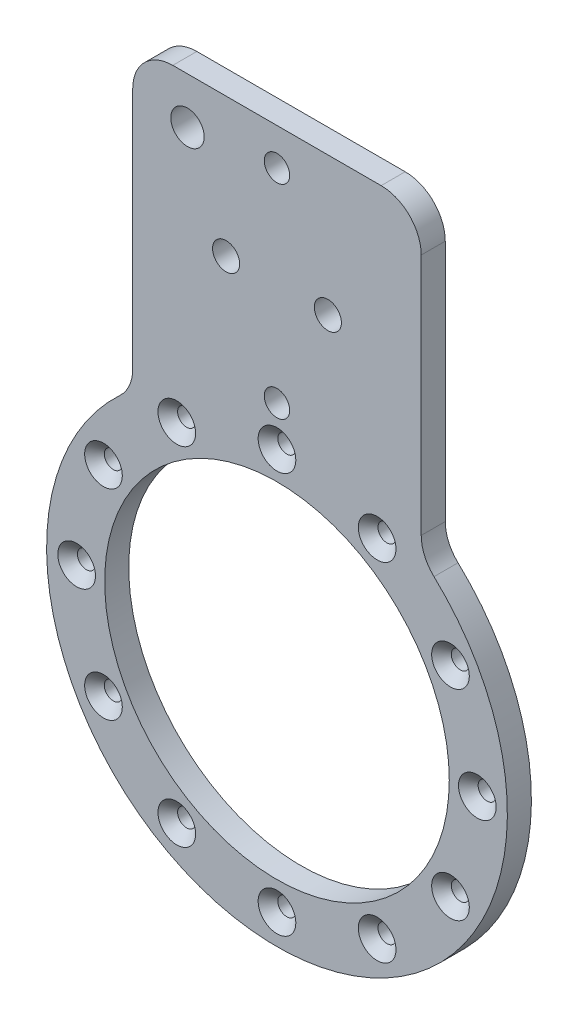
from build123d import *

# Parameters (mm, degrees)
SKETCH1_R                                       = 43
BASE_DEPTH                                      = 3
M4_CLEARANCE_HOLE1_D                            = 4.5
M4_CLEARANCE_HOLE2_D                            = 6.35
F_1_4_CLEARANCE_HOLE1_D                         = 6.7564
FILLET1_R                                       = 10
CSK_FOR_M4_FLAT_HEAD_MACHINE_SCREW1_D           = 4.5
CSK_FOR_M4_FLAT_HEAD_MACHINE_SCREW1_CSINK_D     = 9.4
CSK_FOR_M4_FLAT_HEAD_MACHINE_SCREW1_CSINK_ANGLE = 90
SKETCH15_R                                      = 4.165
CUT_EXTRUDE1_DEPTH                              = 134.200037538


with BuildPart() as part:
    # Sketch1 → base (new, symmetric)
    with BuildSketch(Plane.XY):
        with BuildLine():
            Line((-36, 44.83581158), (-36, 120))
            Line((-36, 120), (36, 120))
            Line((36, 120), (36, 44.83581158))
            ThreePointArc((36, 44.83581158), (0, -57.5), (-36, 44.83581158))
        make_face()
        Circle(SKETCH1_R, mode=Mode.SUBTRACT)
    extrude(amount=BASE_DEPTH, both=True)

    # M4 Clearance Hole1 (through all)
    with Locations(Plane.XY.offset(3)):
        with Locations((0, 50), (25, 43.301270189), (43.301270189, 25), (50, 0), (43.301270189, -25), (25, -43.301270189), (0, -50), (-25, -43.301270189), (-43.301270189, -25), (-50, 0), (-43.301270189, 25), (-25, 43.301270189)):
            Hole(M4_CLEARANCE_HOLE1_D / 2)

    # M4 Clearance Hole2 (through all)
    with Locations(Plane.XY.offset(3)):
        with Locations((0, 60), (0, 110.8)):
            Hole(M4_CLEARANCE_HOLE2_D / 2)

    # 1/4 Clearance Hole1 (through all)
    with Locations(Plane.XY.offset(3)):
        with Locations((-12.7, 85.4), (12.7, 85.4)):
            Hole(F_1_4_CLEARANCE_HOLE1_D / 2)

    # Fillet1
    fillet1_edges = [part.edges().sort_by_distance(p)[0] for p in [
        (36, 120, 0),
        (-36, 120, 0),
        (-36, 44.83581158, 0),
        (36, 44.83581158, 0),
    ]]
    fillet(fillet1_edges, radius=FILLET1_R)

    # CSK for M4 Flat Head Machine Screw1 (through all)
    with Locations(Plane.XY.offset(3)):
        with Locations((0, 50), (25, 43.301270189), (43.301270189, 25), (50, 0), (43.301270189, -25), (25, -43.301270189), (0, -50), (-25, -43.301270189), (-43.301270189, -25), (-50, 0), (-43.301270189, 25), (-25, 43.301270189)):
            CounterSinkHole(CSK_FOR_M4_FLAT_HEAD_MACHINE_SCREW1_D / 2, CSK_FOR_M4_FLAT_HEAD_MACHINE_SCREW1_CSINK_D / 2, counter_sink_angle=CSK_FOR_M4_FLAT_HEAD_MACHINE_SCREW1_CSINK_ANGLE)

    # Sketch15 → Cut-Extrude1 (cut, through all)
    with BuildSketch(Plane(origin=(0, 0, -3), x_dir=(-1, 0, 0), z_dir=(0, 0, -1))):
        with Locations((22.335, 108.435)):
            Circle(SKETCH15_R)
    extrude(amount=-CUT_EXTRUDE1_DEPTH, mode=Mode.SUBTRACT)


solid = part.part
